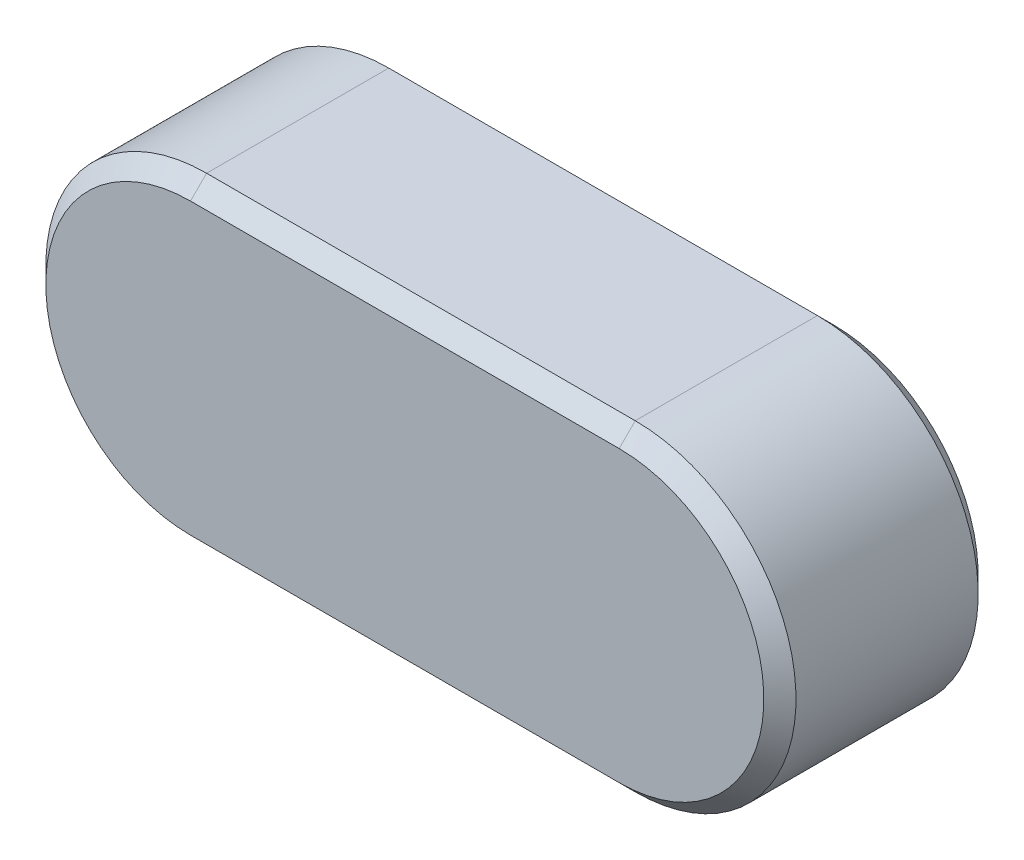
from build123d import *

# Parameters (mm, degrees)
BASEKEY_DEPTH = 4
CHAMFER1_SIZE = 0.6


with BuildPart() as part:
    # Sketch1 → BaseKey (new, symmetric)
    with BuildSketch(Plane.XY):
        with BuildLine():
            Line((-16, 6), (0, 6))
            ThreePointArc((0, 6), (6, 0), (0, -6))
            Line((0, -6), (-16, -6))
            ThreePointArc((-16, -6), (-22, 0), (-16, 6))
        make_face()
    extrude(amount=BASEKEY_DEPTH, both=True)

    # Chamfer1
    chamfer1_edges = [part.edges().sort_by_distance(p)[0] for p in [
        (6, 0, 4),
        (-8, 6, 4),
        (-22, 0, 4),
        (-8, 6, -4),
        (6, 0, -4),
        (-8, -6, -4),
        (-22, 0, -4),
        (-8, -6, 4),
    ]]
    chamfer(chamfer1_edges, length=CHAMFER1_SIZE)


solid = part.part
